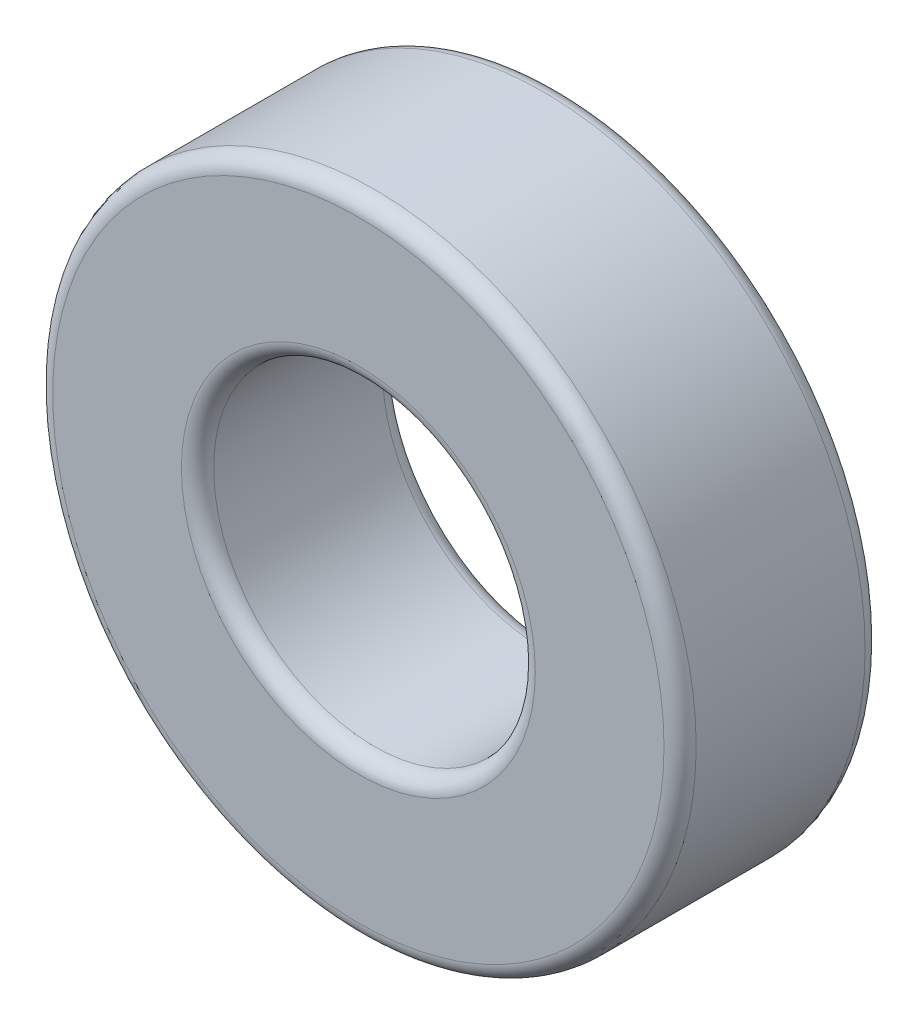
from build123d import *

# Parameters (mm, degrees)
SKETCH1_R           = 4
BOSS_EXTRUDE1_DEPTH = 2.5
SKETCH2_R           = 2
CUT_EXTRUDE1_DEPTH  = 4
FILLET1_R           = 0.2


with BuildPart() as part:
    # Sketch1 → Boss-Extrude1 (new body)
    with BuildSketch(Plane.XY):
        with Locations((60.385500896, 2.915239393)):
            Circle(SKETCH1_R)
    extrude(amount=BOSS_EXTRUDE1_DEPTH)

    # Sketch2 → Cut-Extrude1 (cut)
    with BuildSketch(Plane(origin=(0, 0, 0), x_dir=(-1, 0, 0), z_dir=(0, 0, -1))):
        with Locations((-60.385500896, 2.915239393)):
            Circle(SKETCH2_R)
    extrude(amount=-CUT_EXTRUDE1_DEPTH, mode=Mode.SUBTRACT)

    # Fillet1
    fillet1_edges = [part.edges().sort_by_distance(p)[0] for p in [
        (56.385500896, 2.915239393, 0),
        (56.385500896, 2.915239393, 2.5),
        (62.385500896, 2.915239393, 2.5),
        (62.385500896, 2.915239393, 0),
    ]]
    fillet(fillet1_edges, radius=FILLET1_R)


solid = part.part
